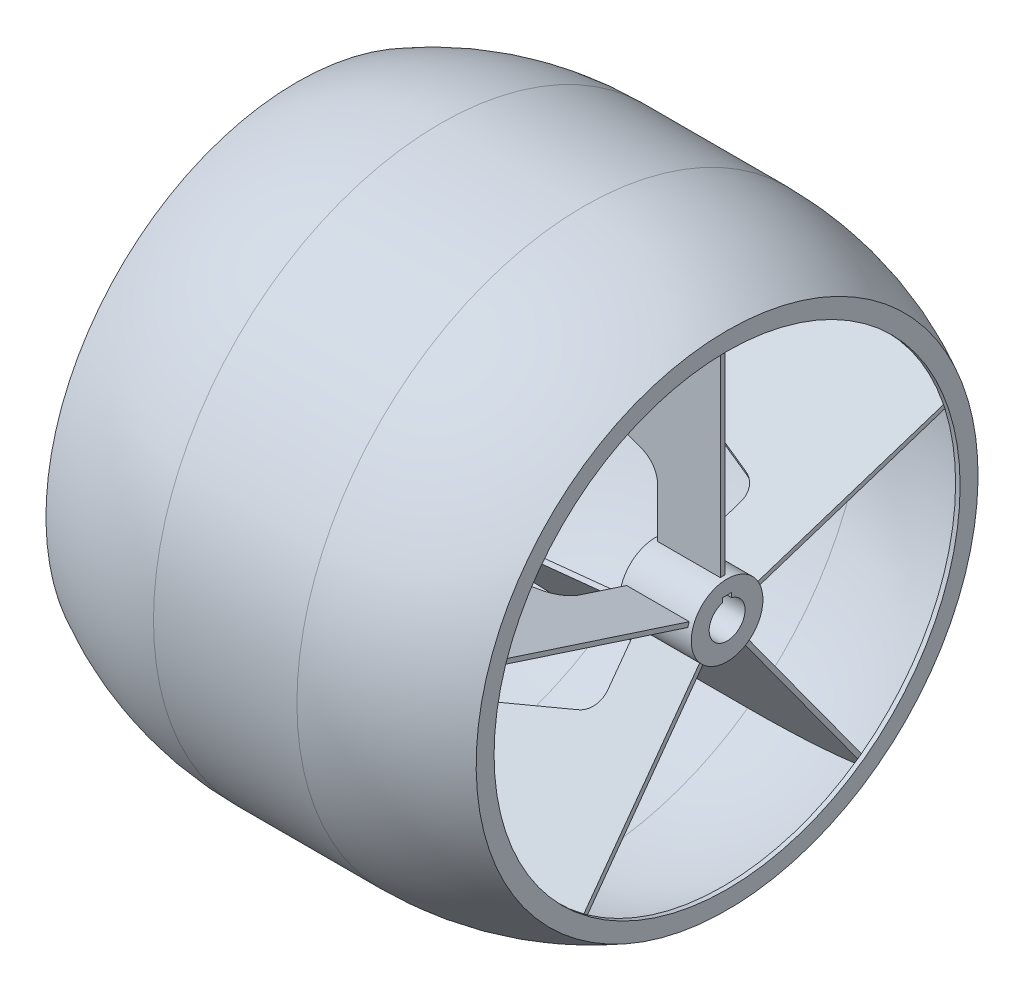
from build123d import *

# Parameters (mm, degrees)
BOSS_EXTRUDE1_START = 50.8
SKETCH2_R           = 12.7
BOSS_EXTRUDE1_DEPTH = 25.4
BOSS_EXTRUDE2_DEPTH = 0.8001
CIRPATTERN1_COUNT   = 5


with BuildPart() as part:
    # Sketch1 → Revolve1 (revolve)
    with BuildSketch(Plane.XY):
        with BuildLine():
            Line((0, 101.6), (25.4, 101.6))
            ThreePointArc((25.4, 101.6), (51.581720723, 98.376882891), (76.2, 88.9))
            Line((76.2, 88.9), (76.2, 82.55))
            Line((76.2, 82.55), (74.5998, 82.55))
            Line((74.5998, 82.55), (74.5998, 87.934991595))
            ThreePointArc((74.5998, 87.934991595), (50.728738233, 96.93956859), (25.4, 99.9998))
            Line((25.4, 99.9998), (0, 99.9998))
            Line((0, 99.9998), (-25.4, 99.9998))
            ThreePointArc((-25.4, 99.9998), (-50.728738233, 96.93956859), (-74.5998, 87.934991595))
            Line((-74.5998, 87.934991595), (-74.5998, 82.55))
            Line((-74.5998, 82.55), (-76.2, 82.55))
            Line((-76.2, 82.55), (-76.2, 88.9))
            ThreePointArc((-76.2, 88.9), (-51.581720723, 98.376882891), (-25.4, 101.6))
            Line((-25.4, 101.6), (0, 101.6))
        make_face()
    revolve(axis=Axis((76.2, 0, 0), (-1, 0, 0)))



with BuildPart() as body_2:
    # Sketch2 → Boss-Extrude1 (new body)
    with BuildSketch(Plane(origin=(0, 0, 0), x_dir=(0, 0, -1), z_dir=(1, 0, 0)).offset(BOSS_EXTRUDE1_START)):
        Circle(SKETCH2_R)
        with BuildLine():
            Line((-1.5875, 6.148361062), (-1.5875, 7.735861062))
            Line((-1.5875, 7.735861062), (1.5875, 7.735861062))
            Line((1.5875, 7.735861062), (1.5875, 6.148361062))
            ThreePointArc((1.5875, 6.148361062), (0, -6.35), (-1.5875, 6.148361062))
        make_face(mode=Mode.SUBTRACT)
    extrude(amount=BOSS_EXTRUDE1_DEPTH)


with BuildPart() as part_1:
    add(part.part)

    add(body_2.part)  # Boss-Extrude2 merges body 2
    # Sketch3 → Boss-Extrude2 (add, symmetric)
    with BuildSketch(Plane.XY):
        with BuildLine():
            Line((74.5998, 87.934991595), (74.5998, 9.525))
            Line((74.5998, 9.525), (52.4002, 9.525))
            Line((52.4002, 9.525), (52.4002, 30.1625))
            ThreePointArc((52.4002, 30.1625), (50.808362477, 35.211163615), (46.608611031, 38.433746242))
            Line((46.608611031, 38.433746242), (-74.5998, 82.55))
            Line((-74.5998, 82.55), (-74.5998, 87.934991595))
            ThreePointArc((-74.5998, 87.934991595), (-50.728738233, 96.93956859), (-25.4, 99.9998))
            Line((-25.4, 99.9998), (25.4, 99.9998))
            ThreePointArc((25.4, 99.9998), (50.728738233, 96.93956859), (74.5998, 87.934991595))
        make_face()
    boss_extrude2 = extrude(amount=BOSS_EXTRUDE2_DEPTH, both=True)

    # CirPattern1: Boss-Extrude2 ×5 about axis
    cirpattern1_axis = Axis((0, 0, 0), (1, 0, 0))
    for i in range(1, CIRPATTERN1_COUNT):
        add(boss_extrude2.rotate(cirpattern1_axis, i * 360 / CIRPATTERN1_COUNT))


solid = part_1.part
